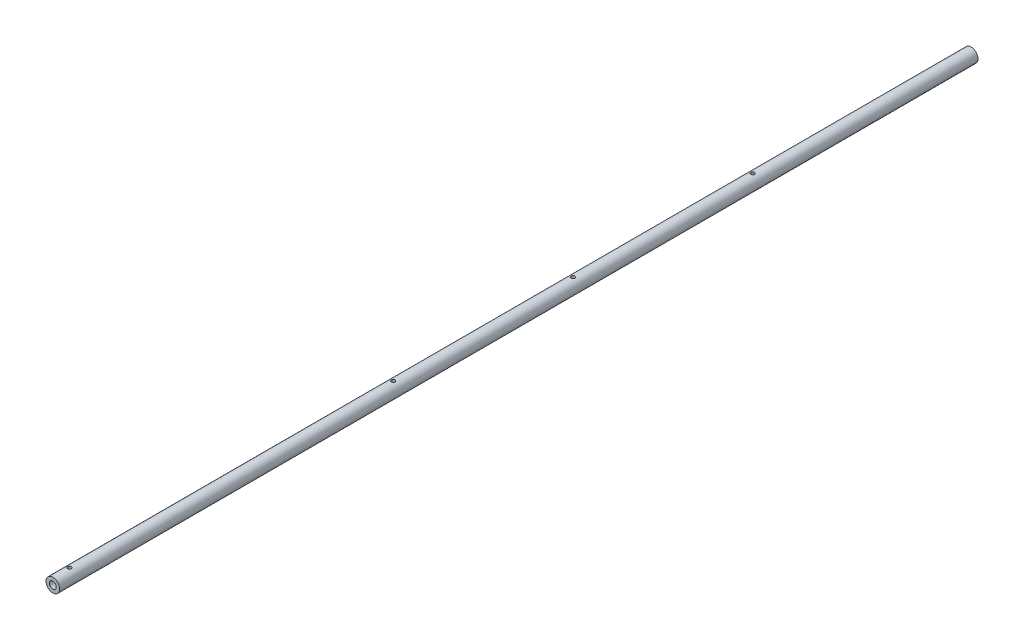
from build123d import *

# Parameters (mm, degrees)
SKETCH1_R        = 7.8613
SKETCH1_R_2      = 3.93065
ROD_DEPTH        = 1054.1
HOLES_DEPTH      = 1055.158626619
HOLES_DEPTH_BACK = 1055.158626619
SKETCH3_R        = 2.1082


with BuildPart() as part:
    # Sketch1 → Rod (new body)
    with BuildSketch(Plane.XY):
        Circle(SKETCH1_R)
        Circle(SKETCH1_R_2, mode=Mode.SUBTRACT)
    extrude(amount=ROD_DEPTH)

    # Sketch3 → Holes (cut, two sides: drawn at the far end of the back side and taken through both)
    with BuildSketch(Plane(origin=(0, 0, 0), x_dir=(1, 0, 0), z_dir=(0, 1, 0)).offset(-HOLES_DEPTH_BACK)):
        with Locations(Location((0, -250.825, 0), (0, 0, 270))):
            Circle(SKETCH3_R)
        with Locations(Location((0, -457.2, 0), (0, 0, 270))):
            Circle(SKETCH3_R)
        with Locations(Location((0, -663.575, 0), (0, 0, 270))):
            Circle(SKETCH3_R)
        with Locations(Location((0, -1035.05, 0), (0, 0, 270))):
            Circle(SKETCH3_R)
    extrude(amount=HOLES_DEPTH + HOLES_DEPTH_BACK, mode=Mode.SUBTRACT)


solid = part.part
